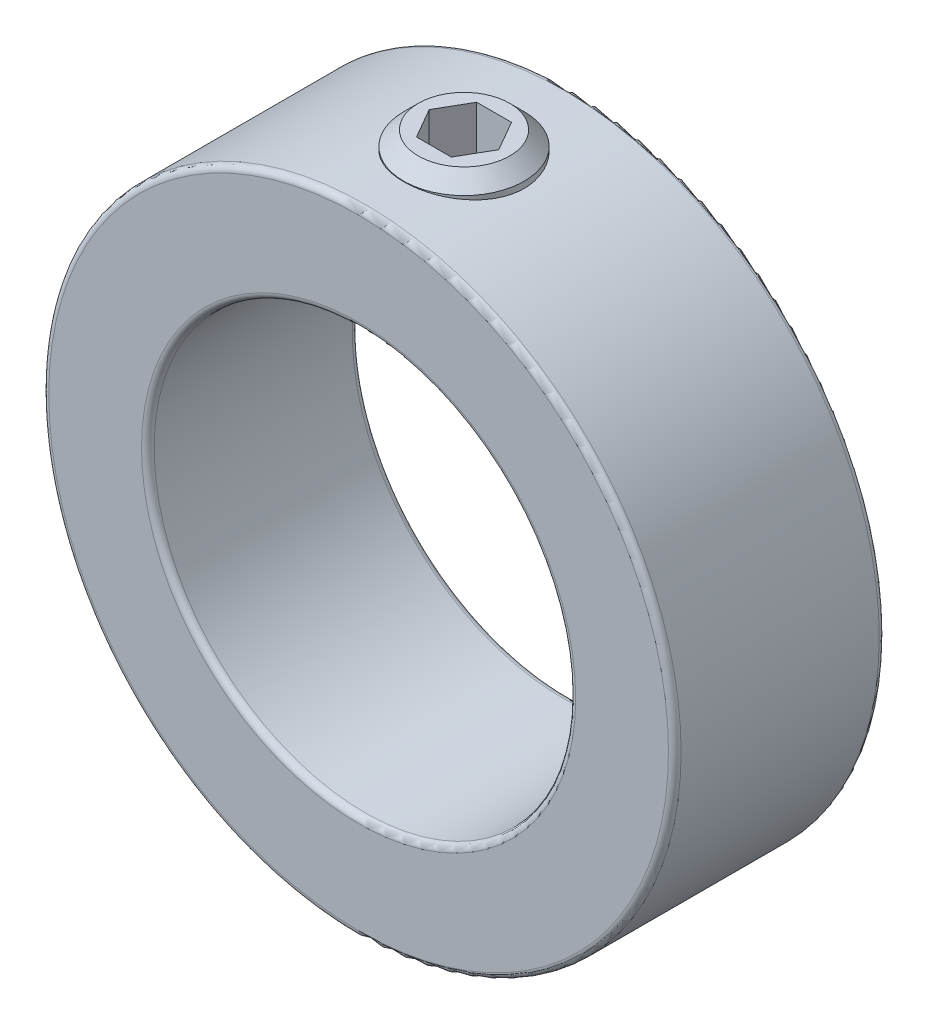
from build123d import *

# Parameters (mm, degrees)
SKETCH1_R          = 33.3375
SKETCH1_R_2        = 22.225
EXTRUDE1_DEPTH     = 11.1125
SKETCH2_R          = 6.35
CUT_EXTRUDE1_DEPTH = 83.47364257
FILLET1_R          = 0.66675
CUT_EXTRUDE2_DEPTH = 6.35


with BuildPart() as part:
    # Sketch1 → Extrude1 (new, symmetric)
    with BuildSketch(Plane.XY):
        Circle(SKETCH1_R)
        Circle(SKETCH1_R_2, mode=Mode.SUBTRACT)
    extrude(amount=EXTRUDE1_DEPTH, both=True)

    # Sketch2 → Cut-Extrude1 (cut, through all)
    with BuildSketch(Plane(origin=(41.275, 0, 0), x_dir=(0, 0, -1), z_dir=(0, -1, 0))):
        with Locations((0, -41.275)):
            Circle(SKETCH2_R)
    extrude(amount=-CUT_EXTRUDE1_DEPTH, mode=Mode.SUBTRACT)

    # Fillet1
    fillet1_edges = [part.edges().sort_by_distance(p)[0] for p in [
        (-33.3375, 0, -11.1125),
        (-33.3375, 0, 11.1125),
        (-22.225, 0, -11.1125),
        (-22.225, 0, 11.1125),
    ]]
    fillet(fillet1_edges, radius=FILLET1_R)


with BuildPart() as body_2:
    # Sketch3 → Revolve1 (revolve)
    with BuildSketch(Plane.XY):
        Polygon((-4.816385262, 22.225), (-1.840337685, 22.225), (0, 24.065337685), (0, 34.925), (-4.816385262, 34.925), (-6.35, 33.391385262), (-6.35, 23.758614738), align=None)
    revolve(axis=Axis((0, 22.225, 0), (0, -1, 0)))

    # Sketch4 → Cut-Extrude2 (cut)
    with BuildSketch(Plane(origin=(3.3734375, 34.925, 0), x_dir=(0, 0, -1), z_dir=(0, -1, 0))):
        Polygon((0, 0.292736709), (-3.175, -1.540350395), (-3.175, -5.206524605), (0, -7.039611709), (3.175, -5.206524605), (3.175, -1.540350395), align=None)
    extrude(amount=CUT_EXTRUDE2_DEPTH, mode=Mode.SUBTRACT)


solid = Compound([part.part, body_2.part])
